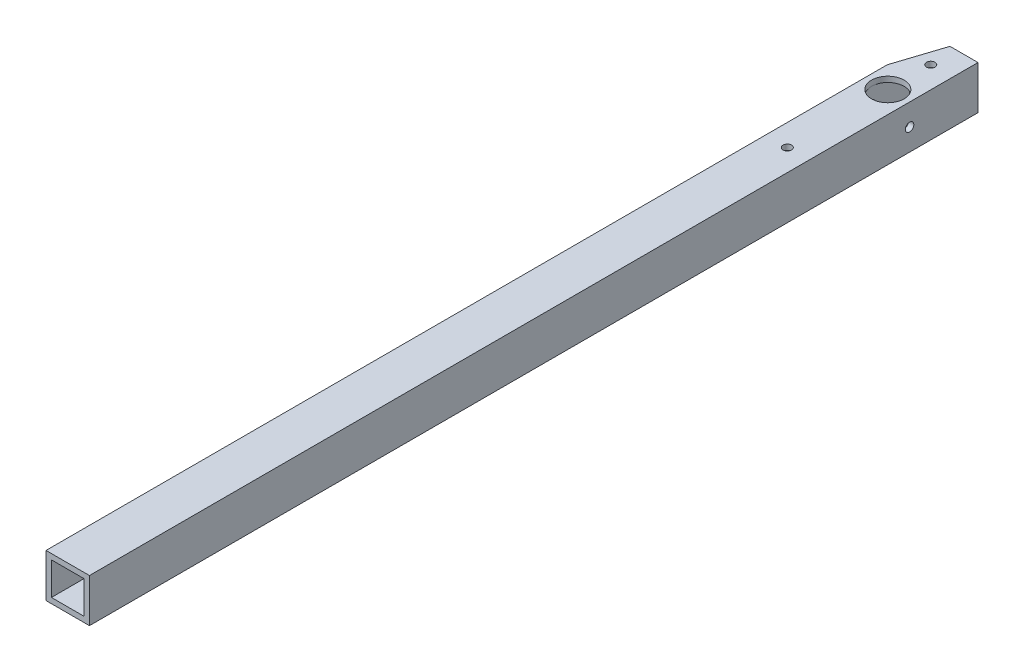
from build123d import *

# Parameters (mm, degrees)
BOSS_EXTRUDE1_DEPTH      = 266.7
BOSS_EXTRUDE1_DEPTH_BACK = 266.7
SKETCH3_W                = 25.4
SKETCH3_H                = 25.4
SKETCH3_W_2              = 19.05
SKETCH3_H_2              = 19.05
SKETCH4_R                = 9.525
CUT_EXTRUDE1_DEPTH       = 25.4
SKETCH5_R                = 9.525
CUT_EXTRUDE2_DEPTH       = 3.175
F_10_CLEARANCE_HOLE1_D   = 4.9784
F_10_CLEARANCE_HOLE2_D   = 4.9784


with BuildPart() as part:
    # Sketch3 → Boss-Extrude1 (new, two sides: drawn at the far end of the back side and taken through both)
    with BuildSketch(Plane.XY.offset(-BOSS_EXTRUDE1_DEPTH_BACK)):
        Rectangle(SKETCH3_W, SKETCH3_H)
        Rectangle(SKETCH3_W_2, SKETCH3_H_2, mode=Mode.SUBTRACT)
    extrude(amount=BOSS_EXTRUDE1_DEPTH + BOSS_EXTRUDE1_DEPTH_BACK)

    # Sketch4 → Cut-Extrude1 (cut)
    with BuildSketch(Plane(origin=(0, 12.7, 0), x_dir=(1, 0, 0), z_dir=(0, 1, 0))):
        with Locations(Location((0, 212.725, 0), (0, 0, 180))):
            Circle(SKETCH4_R)
        Polygon((-12.7, 225.013453558), (-12.7, 266.7), (12.7, 266.7), (12.7, 252.73), (-3.69434815, 252.73), align=None)
    extrude(amount=-CUT_EXTRUDE1_DEPTH, mode=Mode.SUBTRACT)

    # Sketch5 → Cut-Extrude2 (cut)
    with BuildSketch(Plane.XZ.offset(12.7)):
        with Locations((-0.660548484, -179.870948658)):
            Circle(SKETCH5_R)
    extrude(amount=-CUT_EXTRUDE2_DEPTH, mode=Mode.SUBTRACT)

    # #10 Clearance Hole1 (through all)
    with Locations(Plane(origin=(12.7, 0, 0), x_dir=(0, 0, -1), z_dir=(1, 0, 0))):
        with Locations((212.725, 0)):
            Hole(F_10_CLEARANCE_HOLE1_D / 2)

    # #10 Clearance Hole2 (through all)
    with Locations(Plane(origin=(0, 12.7, 0), x_dir=(1, 0, 0), z_dir=(0, 1, 0))):
        with Locations((0, 153.95996007), (0, 237.806480142)):
            Hole(F_10_CLEARANCE_HOLE2_D / 2)


solid = part.part
